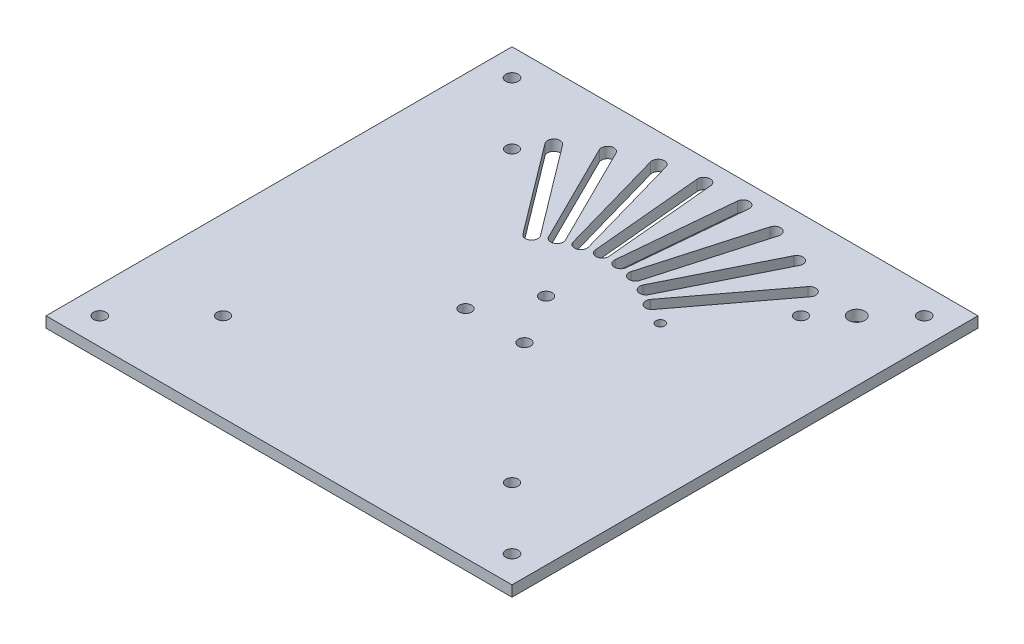
from build123d import *

# Parameters (mm, degrees)
SKETCH2_W                 = 130
SKETCH2_H                 = 130
BOSS_EXTRUDE1_DEPTH       = 3
CORNERPIECE_HOLES_REACH   = 93.973
SKETCH4_R                 = 1.75
CUT_EXTRUDE2_REACH        = 93.973
SKETCH6_R                 = 1.7
CUT_EXTRUDE3_REACH        = 93.973
SKETCH8_R                 = 1.7
PRIMARY_WIRE_HOLE_REACH   = 93.973
SKETCH9_R                 = 2.25
SECONDARY_WIRE_HOLE_REACH = 93.973
SKETCH10_R                = 1.25
CUT_EXTRUDE6_REACH        = 93.973


with BuildPart() as part:
    # Sketch2 → Boss-Extrude1 (new body)
    with BuildSketch(Plane(origin=(0, 0, 0), x_dir=(1, 0, 0), z_dir=(0, 1, 0))):
        Rectangle(SKETCH2_W, SKETCH2_H)
    extrude(amount=BOSS_EXTRUDE1_DEPTH)

    # Sketch4 → Cornerpiece holes (cut, up to next)
    with BuildSketch(Plane(origin=(0, 3, 0), x_dir=(1, 0, 0), z_dir=(0, 1, 0)), mode=Mode.PRIVATE) as cornerpiece_holes_sk1:
        with Locations(Location((-57.5, 57.5, 0), (0, 0, 270))):
            Circle(SKETCH4_R)
    cornerpiece_holes_tool1 = extrude(cornerpiece_holes_sk1.sketch, amount=-CORNERPIECE_HOLES_REACH, mode=Mode.PRIVATE) & part.part
    # Sketch4 → Cornerpiece holes (cut, up to next)
    with BuildSketch(Plane(origin=(0, 3, 0), x_dir=(1, 0, 0), z_dir=(0, 1, 0)), mode=Mode.PRIVATE) as cornerpiece_holes_sk2:
        with Locations(Location((57.5, 57.5, 0), (0, 0, 270))):
            Circle(SKETCH4_R)
    cornerpiece_holes_tool2 = extrude(cornerpiece_holes_sk2.sketch, amount=-CORNERPIECE_HOLES_REACH, mode=Mode.PRIVATE) & part.part
    # Sketch4 → Cornerpiece holes (cut, up to next)
    with BuildSketch(Plane(origin=(0, 3, 0), x_dir=(1, 0, 0), z_dir=(0, 1, 0)), mode=Mode.PRIVATE) as cornerpiece_holes_sk3:
        with Locations(Location((57.5, -57.5, 0), (0, 0, 270))):
            Circle(SKETCH4_R)
    cornerpiece_holes_tool3 = extrude(cornerpiece_holes_sk3.sketch, amount=-CORNERPIECE_HOLES_REACH, mode=Mode.PRIVATE) & part.part
    # Sketch4 → Cornerpiece holes (cut, up to next)
    with BuildSketch(Plane(origin=(0, 3, 0), x_dir=(1, 0, 0), z_dir=(0, 1, 0)), mode=Mode.PRIVATE) as cornerpiece_holes_sk4:
        with Locations(Location((-57.5, -57.5, 0), (0, 0, 270))):
            Circle(SKETCH4_R)
    cornerpiece_holes_tool4 = extrude(cornerpiece_holes_sk4.sketch, amount=-CORNERPIECE_HOLES_REACH, mode=Mode.PRIVATE) & part.part
    add(cornerpiece_holes_tool1.solids().sort_by_distance((-57.5, 3, -57.5))[0], mode=Mode.SUBTRACT)
    add(cornerpiece_holes_tool2.solids().sort_by_distance((57.5, 3, -57.5))[0], mode=Mode.SUBTRACT)
    add(cornerpiece_holes_tool3.solids().sort_by_distance((57.5, 3, 57.5))[0], mode=Mode.SUBTRACT)
    add(cornerpiece_holes_tool4.solids().sort_by_distance((-57.5, 3, 57.5))[0], mode=Mode.SUBTRACT)

    # Sketch6 → Cut-Extrude2 (cut, up to next)
    with BuildSketch(Plane(origin=(0, 3, 0), x_dir=(1, 0, 0), z_dir=(0, 1, 0)), mode=Mode.PRIVATE) as cut_extrude2_sk1:
        with Locations(Location((-40.305086528, 40.305086528, 0), (0, 0, 270))):
            Circle(SKETCH6_R)
    cut_extrude2_tool1 = extrude(cut_extrude2_sk1.sketch, amount=-CUT_EXTRUDE2_REACH, mode=Mode.PRIVATE) & part.part
    # Sketch6 → Cut-Extrude2 (cut, up to next)
    with BuildSketch(Plane(origin=(0, 3, 0), x_dir=(1, 0, 0), z_dir=(0, 1, 0)), mode=Mode.PRIVATE) as cut_extrude2_sk2:
        with Locations(Location((40.305086528, 40.305086528, 0), (0, 0, 270))):
            Circle(SKETCH6_R)
    cut_extrude2_tool2 = extrude(cut_extrude2_sk2.sketch, amount=-CUT_EXTRUDE2_REACH, mode=Mode.PRIVATE) & part.part
    # Sketch6 → Cut-Extrude2 (cut, up to next)
    with BuildSketch(Plane(origin=(0, 3, 0), x_dir=(1, 0, 0), z_dir=(0, 1, 0)), mode=Mode.PRIVATE) as cut_extrude2_sk3:
        with Locations(Location((40.305086528, -40.305086528, 0), (0, 0, 270))):
            Circle(SKETCH6_R)
    cut_extrude2_tool3 = extrude(cut_extrude2_sk3.sketch, amount=-CUT_EXTRUDE2_REACH, mode=Mode.PRIVATE) & part.part
    # Sketch6 → Cut-Extrude2 (cut, up to next)
    with BuildSketch(Plane(origin=(0, 3, 0), x_dir=(1, 0, 0), z_dir=(0, 1, 0)), mode=Mode.PRIVATE) as cut_extrude2_sk4:
        with Locations(Location((-40.305086528, -40.305086528, 0), (0, 0, 270))):
            Circle(SKETCH6_R)
    cut_extrude2_tool4 = extrude(cut_extrude2_sk4.sketch, amount=-CUT_EXTRUDE2_REACH, mode=Mode.PRIVATE) & part.part
    add(cut_extrude2_tool1.solids().sort_by_distance((-40.305087, 3, -40.305087))[0], mode=Mode.SUBTRACT)
    add(cut_extrude2_tool2.solids().sort_by_distance((40.305087, 3, -40.305087))[0], mode=Mode.SUBTRACT)
    add(cut_extrude2_tool3.solids().sort_by_distance((40.305087, 3, 40.305087))[0], mode=Mode.SUBTRACT)
    add(cut_extrude2_tool4.solids().sort_by_distance((-40.305087, 3, 40.305087))[0], mode=Mode.SUBTRACT)

    # Sketch8 → Cut-Extrude3 (cut, up to next)
    with BuildSketch(Plane(origin=(0, 3, 0), x_dir=(1, 0, 0), z_dir=(0, 1, 0)), mode=Mode.PRIVATE) as cut_extrude3_sk1:
        with Locations(Location((0, 9.5, 0), (0, 0, 270))):
            Circle(SKETCH8_R)
    cut_extrude3_tool1 = extrude(cut_extrude3_sk1.sketch, amount=-CUT_EXTRUDE3_REACH, mode=Mode.PRIVATE) & part.part
    # Sketch8 → Cut-Extrude3 (cut, up to next)
    with BuildSketch(Plane(origin=(0, 3, 0), x_dir=(1, 0, 0), z_dir=(0, 1, 0)), mode=Mode.PRIVATE) as cut_extrude3_sk2:
        with Locations(Location((8.227241336, -4.75, 0), (0, 0, 270))):
            Circle(SKETCH8_R)
    cut_extrude3_tool2 = extrude(cut_extrude3_sk2.sketch, amount=-CUT_EXTRUDE3_REACH, mode=Mode.PRIVATE) & part.part
    # Sketch8 → Cut-Extrude3 (cut, up to next)
    with BuildSketch(Plane(origin=(0, 3, 0), x_dir=(1, 0, 0), z_dir=(0, 1, 0)), mode=Mode.PRIVATE) as cut_extrude3_sk3:
        with Locations(Location((-8.227241336, -4.75, 0), (0, 0, 270))):
            Circle(SKETCH8_R)
    cut_extrude3_tool3 = extrude(cut_extrude3_sk3.sketch, amount=-CUT_EXTRUDE3_REACH, mode=Mode.PRIVATE) & part.part
    add(cut_extrude3_tool1.solids().sort_by_distance((0, 3, -9.5))[0], mode=Mode.SUBTRACT)
    add(cut_extrude3_tool2.solids().sort_by_distance((8.227241, 3, 4.75))[0], mode=Mode.SUBTRACT)
    add(cut_extrude3_tool3.solids().sort_by_distance((-8.227241, 3, 4.75))[0], mode=Mode.SUBTRACT)

    # Sketch9 → Primary wire hole (cut, up to next)
    with BuildSketch(Plane(origin=(0, 3, 0), x_dir=(1, 0, 0), z_dir=(0, 1, 0)), mode=Mode.PRIVATE) as primary_wire_hole_sk1:
        with Locations(Location((48.083261121, 48.083261121, 0), (0, 0, 270))):
            Circle(SKETCH9_R)
    primary_wire_hole_tool1 = extrude(primary_wire_hole_sk1.sketch, amount=-PRIMARY_WIRE_HOLE_REACH, mode=Mode.PRIVATE) & part.part
    add(primary_wire_hole_tool1.solids().sort_by_distance((48.083261, 3, -48.083261))[0], mode=Mode.SUBTRACT)

    # Sketch10 → Secondary wire hole (cut, up to next)
    with BuildSketch(Plane(origin=(0, 3, 0), x_dir=(1, 0, 0), z_dir=(0, 1, 0)), mode=Mode.PRIVATE) as secondary_wire_hole_sk1:
        with Locations(Location((22.506385739, 18.885099973, 0), (0, 0, 270))):
            Circle(SKETCH10_R)
    secondary_wire_hole_tool1 = extrude(secondary_wire_hole_sk1.sketch, amount=-SECONDARY_WIRE_HOLE_REACH, mode=Mode.PRIVATE) & part.part
    add(secondary_wire_hole_tool1.solids().sort_by_distance((22.506386, 3, -18.8851))[0], mode=Mode.SUBTRACT)

    # Sketch11 → Cut-Extrude6 (cut, up to next)
    with BuildSketch(Plane(origin=(0, 3, 0), x_dir=(1, 0, 0), z_dir=(0, 1, 0)), mode=Mode.PRIVATE) as cut_extrude6_sk1:
        with BuildLine():
            Line((-34.259927979, 48.372330261), (-15.380990703, 23.319134311))
            ThreePointArc((-15.380990703, 23.319134311), (-15.725426555, 20.868345878), (-18.176214988, 21.21278173))
            Line((-18.176214988, 21.21278173), (-37.055152264, 46.26597768))
            ThreePointArc((-37.055152264, 46.26597768), (-36.710716412, 48.716766113), (-34.259927979, 48.372330261))
        make_face()
    cut_extrude6_tool1 = extrude(cut_extrude6_sk1.sketch, amount=-CUT_EXTRUDE6_REACH, mode=Mode.PRIVATE) & part.part
    # Sketch11 → Cut-Extrude6 (cut, up to next)
    with BuildSketch(Plane(origin=(0, 3, 0), x_dir=(1, 0, 0), z_dir=(0, 1, 0)), mode=Mode.PRIVATE) as cut_extrude6_sk2:
        with BuildLine():
            Line((-27.938203096, 52.278884913), (-13.975987518, 24.187365977))
            ThreePointArc((-13.975987518, 24.187365977), (-11.629987027, 23.399151731), (-10.841772782, 25.745152222))
            Line((-10.841772782, 25.745152222), (-24.80398836, 53.836671159))
            ThreePointArc((-24.80398836, 53.836671159), (-27.149988851, 54.624885404), (-27.938203096, 52.278884913))
        make_face()
    cut_extrude6_tool2 = extrude(cut_extrude6_sk2.sketch, amount=-CUT_EXTRUDE6_REACH, mode=Mode.PRIVATE) & part.part
    # Sketch11 → Cut-Extrude6 (cut, up to next)
    with BuildSketch(Plane(origin=(0, 3, 0), x_dir=(1, 0, 0), z_dir=(0, 1, 0)), mode=Mode.PRIVATE) as cut_extrude6_sk3:
        with BuildLine():
            Line((-17.87286129, 56.517128637), (-9.301329978, 26.340883824))
            ThreePointArc((-9.301329978, 26.340883824), (-7.139754963, 25.135647974), (-5.934519112, 27.297222989))
            Line((-5.934519112, 27.297222989), (-14.506050425, 57.473467801))
            ThreePointArc((-14.506050425, 57.473467801), (-16.667625439, 58.678703651), (-17.87286129, 56.517128637))
        make_face()
    cut_extrude6_tool3 = extrude(cut_extrude6_sk3.sketch, amount=-CUT_EXTRUDE6_REACH, mode=Mode.PRIVATE) & part.part
    # Sketch11 → Cut-Extrude6 (cut, up to next)
    with BuildSketch(Plane(origin=(0, 3, 0), x_dir=(1, 0, 0), z_dir=(0, 1, 0)), mode=Mode.PRIVATE) as cut_extrude6_sk4:
        with BuildLine():
            Line((-7.200805802, 58.836837065), (-4.310928692, 27.600231771))
            ThreePointArc((-4.310928692, 27.600231771), (-2.407156164, 26.018887355), (-0.825811748, 27.922659883))
            Line((-0.825811748, 27.922659883), (-3.715688858, 59.159265177))
            ThreePointArc((-3.715688858, 59.159265177), (-5.619461386, 60.740609593), (-7.200805802, 58.836837065))
        make_face()
    cut_extrude6_tool4 = extrude(cut_extrude6_sk4.sketch, amount=-CUT_EXTRUDE6_REACH, mode=Mode.PRIVATE) & part.part
    # Sketch11 → Cut-Extrude6 (cut, up to next)
    with BuildSketch(Plane(origin=(0, 3, 0), x_dir=(1, 0, 0), z_dir=(0, 1, 0)), mode=Mode.PRIVATE) as cut_extrude6_sk5:
        with BuildLine():
            Line((3.715688858, 59.159265177), (0.825811748, 27.922659883))
            ThreePointArc((0.825811748, 27.922659883), (2.407156164, 26.018887355), (4.310928692, 27.600231771))
            Line((4.310928692, 27.600231771), (7.200805802, 58.836837065))
            ThreePointArc((7.200805802, 58.836837065), (5.619461386, 60.740609593), (3.715688858, 59.159265177))
        make_face()
    cut_extrude6_tool5 = extrude(cut_extrude6_sk5.sketch, amount=-CUT_EXTRUDE6_REACH, mode=Mode.PRIVATE) & part.part
    # Sketch11 → Cut-Extrude6 (cut, up to next)
    with BuildSketch(Plane(origin=(0, 3, 0), x_dir=(1, 0, 0), z_dir=(0, 1, 0)), mode=Mode.PRIVATE) as cut_extrude6_sk6:
        with BuildLine():
            Line((14.506050425, 57.473467801), (5.934519112, 27.297222989))
            ThreePointArc((5.934519112, 27.297222989), (7.139754963, 25.135647974), (9.301329978, 26.340883824))
            Line((9.301329978, 26.340883824), (17.87286129, 56.517128637))
            ThreePointArc((17.87286129, 56.517128637), (16.667625439, 58.678703651), (14.506050425, 57.473467801))
        make_face()
    cut_extrude6_tool6 = extrude(cut_extrude6_sk6.sketch, amount=-CUT_EXTRUDE6_REACH, mode=Mode.PRIVATE) & part.part
    # Sketch11 → Cut-Extrude6 (cut, up to next)
    with BuildSketch(Plane(origin=(0, 3, 0), x_dir=(1, 0, 0), z_dir=(0, 1, 0)), mode=Mode.PRIVATE) as cut_extrude6_sk7:
        with BuildLine():
            Line((24.80398836, 53.836671159), (10.841772782, 25.745152222))
            ThreePointArc((10.841772782, 25.745152222), (11.629987027, 23.399151731), (13.975987518, 24.187365977))
            Line((13.975987518, 24.187365977), (27.938203096, 52.278884913))
            ThreePointArc((27.938203096, 52.278884913), (27.149988851, 54.624885404), (24.80398836, 53.836671159))
        make_face()
    cut_extrude6_tool7 = extrude(cut_extrude6_sk7.sketch, amount=-CUT_EXTRUDE6_REACH, mode=Mode.PRIVATE) & part.part
    # Sketch11 → Cut-Extrude6 (cut, up to next)
    with BuildSketch(Plane(origin=(0, 3, 0), x_dir=(1, 0, 0), z_dir=(0, 1, 0)), mode=Mode.PRIVATE) as cut_extrude6_sk8:
        with BuildLine():
            Line((34.259927979, 48.372330261), (15.380990703, 23.319134311))
            ThreePointArc((15.380990703, 23.319134311), (15.725426555, 20.868345878), (18.176214988, 21.21278173))
            Line((18.176214988, 21.21278173), (37.055152264, 46.26597768))
            ThreePointArc((37.055152264, 46.26597768), (36.710716412, 48.716766113), (34.259927979, 48.372330261))
        make_face()
    cut_extrude6_tool8 = extrude(cut_extrude6_sk8.sketch, amount=-CUT_EXTRUDE6_REACH, mode=Mode.PRIVATE) & part.part
    add(cut_extrude6_tool1.solids().sort_by_distance((-26.218071, 3, -34.792556))[0], mode=Mode.SUBTRACT)
    add(cut_extrude6_tool2.solids().sort_by_distance((-19.389988, 3, -39.012019))[0], mode=Mode.SUBTRACT)
    add(cut_extrude6_tool3.solids().sort_by_distance((-11.90369, 3, -41.907176))[0], mode=Mode.SUBTRACT)
    add(cut_extrude6_tool4.solids().sort_by_distance((-4.013309, 3, -43.379748))[0], mode=Mode.SUBTRACT)
    add(cut_extrude6_tool5.solids().sort_by_distance((4.013309, 3, -43.379748))[0], mode=Mode.SUBTRACT)
    add(cut_extrude6_tool6.solids().sort_by_distance((11.90369, 3, -41.907176))[0], mode=Mode.SUBTRACT)
    add(cut_extrude6_tool7.solids().sort_by_distance((19.389988, 3, -39.012019))[0], mode=Mode.SUBTRACT)
    add(cut_extrude6_tool8.solids().sort_by_distance((26.218071, 3, -34.792556))[0], mode=Mode.SUBTRACT)


solid = part.part
